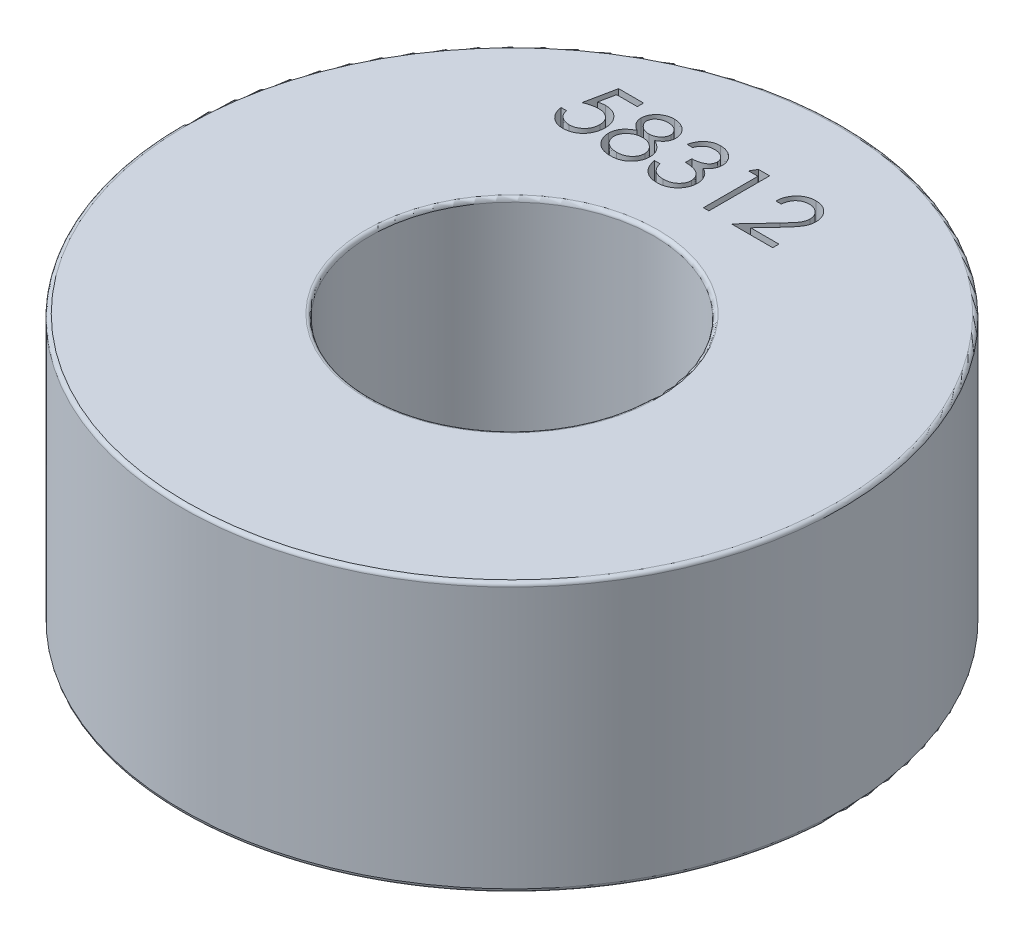
from build123d import *

# Parameters (mm, degrees)
CUT_EXTRUDE1_DEPTH = 1


with BuildPart() as part:
    # Toroidal Core TC229 → Revolve2 (revolve)
    with BuildSketch(Plane.XY, mode=Mode.PRIVATE) as revolve2_sk:
        with BuildLine():
            Line((5.719098459, 0), (12.780901541, 0))
            ThreePointArc((12.780901541, 0), (12.884180468, 0.042779532), (12.92696, 0.146058459))
            Line((12.92696, 0.146058459), (12.92696, 10.397861541))
            ThreePointArc((12.92696, 10.397861541), (12.884180468, 10.501140468), (12.780901541, 10.54392))
            Line((12.780901541, 10.54392), (5.719098459, 10.54392))
            ThreePointArc((5.719098459, 10.54392), (5.615819532, 10.501140468), (5.57304, 10.397861541))
            Line((5.57304, 10.397861541), (5.57304, 0.146058459))
            ThreePointArc((5.57304, 0.146058459), (5.615819532, 0.042779532), (5.719098459, 0))
        make_face()
    revolve(revolve2_sk.sketch.rotate(Axis((0, -8.107972275, 0), (0, 1, 0)), 90), axis=Axis((0, -8.107972275, 0), (0, 1, 0)))

    # Sketch1 → Cut-Extrude1 (cut)
    # profile 1 of 5: a face of its own
    with BuildSketch(Plane(origin=(0, 10.54392, 0), x_dir=(1, 0, 0), z_dir=(0, 1, 0))):
        with BuildLine():
            Line((-4.580535141, 9.741003225), (-4.580535141, 9.496772456))
            Line((-4.580535141, 9.496772456), (-5.39050359, 9.496772456))
            Line((-5.39050359, 9.496772456), (-5.518820147, 8.870454097))
            add(Edge.make_bspline(
                [(-5.518820147, 8.870454097), (-5.493608918, 8.877414335), (-5.444766149, 8.890898696), (-5.372675601, 8.90587048), (-5.304236977, 8.914895719), (-5.259826412, 8.916128057), (-5.238336372, 8.916724379)],
                knots=[0, 0, 0, 0, 1.100273476, 2.13160584, 3.095893838, 4, 4, 4, 4], degree=3))
            add(Edge.make_bspline(
                [(-5.238336372, 8.916724379), (-5.211745471, 8.916148841), (-5.159461115, 8.915017188), (-5.082962474, 8.904150627), (-5.009937774, 8.887046506), (-4.940539733, 8.863152008), (-4.874639965, 8.832597351), (-4.812844785, 8.794429355), (-4.754226633, 8.749843285), (-4.699837119, 8.698581768), (-4.650494687, 8.642165454), (-4.607111041, 8.58150626), (-4.570261136, 8.51719369), (-4.540624265, 8.448613275), (-4.516958495, 8.376523209), (-4.50120687, 8.300164969), (-4.490718002, 8.220258302), (-4.489546164, 8.165622514), (-4.488948602, 8.137761789)],
                knots=[0, 0, 0, 0, 1.052922333, 2.070308379, 3.05430497, 4.020497103, 4.973039431, 5.925935799, 6.892292201, 7.88610001, 8.88166317, 9.857072816, 10.836096531, 11.812156883, 12.81219415, 13.836441305, 14.89672472, 16, 16, 16, 16], degree=3))
            add(Edge.make_bspline(
                [(-4.488948602, 8.137761789), (-4.489401091, 8.118356493), (-4.490299953, 8.079808146), (-4.494870992, 8.022560038), (-4.503671899, 7.966523896), (-4.515488154, 7.911692287), (-4.530825049, 7.858169017), (-4.549391352, 7.805800888), (-4.572112578, 7.754913843), (-4.597034996, 7.705026387), (-4.625097332, 7.657266331), (-4.656243066, 7.612601575), (-4.689148874, 7.57036209), (-4.724555602, 7.53100089), (-4.76279235, 7.494776622), (-4.803396042, 7.461474309), (-4.846042678, 7.430530761), (-4.891392048, 7.403202043), (-4.93843363, 7.378054032), (-4.987846756, 7.357423196), (-5.038506626, 7.338978355), (-5.091142372, 7.324276158), (-5.145634769, 7.312755974), (-5.202073643, 7.304931458), (-5.260162992, 7.299232489), (-5.29953867, 7.298875739), (-5.31942862, 7.298695533)],
                knots=[0, 0, 0, 0, 1.056347294, 2.098418968, 3.122841568, 4.141288669, 5.149314143, 6.15115421, 7.162517403, 8.180376062, 9.185164535, 10.17417709, 11.141909838, 12.097768115, 13.052685741, 14.0056014, 14.954263652, 15.917497458, 16.885230207, 17.854509472, 18.828990115, 19.81800267, 20.826176721, 21.857883937, 22.917946725, 24, 24, 24, 24], degree=3))
            add(Edge.make_bspline(
                [(-5.31942862, 7.298695533), (-5.343155518, 7.29916555), (-5.389835387, 7.300090252), (-5.458225273, 7.3097639), (-5.524025745, 7.323618636), (-5.586707118, 7.344462241), (-5.646831138, 7.370579311), (-5.70358838, 7.403587635), (-5.758429096, 7.440993061), (-5.809123892, 7.485134872), (-5.856174748, 7.533382863), (-5.898293283, 7.585741544), (-5.935803806, 7.641346753), (-5.96810563, 7.700468533), (-5.995658748, 7.762951534), (-6.017304303, 7.829029861), (-6.034774755, 7.898358257), (-6.042165761, 7.946087699), (-6.045919756, 7.970330148)],
                knots=[0, 0, 0, 0, 1.0467383, 2.05933395, 3.04377827, 4.011590433, 4.970194871, 5.932262533, 6.905835911, 7.896367577, 8.894135286, 9.877477877, 10.858688626, 11.851381753, 12.8477658, 13.868841284, 14.917554742, 16, 16, 16, 16], degree=3))
            Line((-6.045919756, 7.970330148), (-5.832217833, 7.970330148))
            add(Edge.make_bspline(
                [(-5.832217833, 7.970330148), (-5.826959654, 7.947622241), (-5.816853141, 7.903976381), (-5.794669587, 7.842654879), (-5.767546554, 7.788009121), (-5.735294667, 7.739316244), (-5.69682045, 7.696855837), (-5.652917392, 7.659016372), (-5.603695102, 7.624879364), (-5.548998994, 7.596424946), (-5.491295809, 7.572157455), (-5.430902404, 7.555997819), (-5.369463197, 7.544635248), (-5.327908091, 7.543497853), (-5.307026276, 7.542926302)],
                knots=[0, 0, 0, 0, 1.136247022, 2.183929868, 3.172523383, 4.106158343, 5.02341133, 5.958108904, 6.928429099, 7.938127109, 8.96079061, 9.975095812, 10.982467395, 12, 12, 12, 12], degree=3))
            add(Edge.make_bspline(
                [(-5.307026276, 7.542926302), (-5.286643835, 7.543484724), (-5.24651064, 7.544584262), (-5.187447893, 7.553047233), (-5.130425206, 7.566081223), (-5.076005236, 7.585586964), (-5.023235689, 7.609293817), (-4.973451391, 7.639716038), (-4.925212112, 7.674727229), (-4.880017257, 7.714838794), (-4.838624703, 7.759041389), (-4.802051342, 7.80631083), (-4.77158705, 7.856736756), (-4.745914379, 7.909446169), (-4.726419903, 7.965016759), (-4.712512735, 8.023188094), (-4.704346368, 8.084103858), (-4.703222976, 8.125652799), (-4.702650525, 8.14682504)],
                knots=[0, 0, 0, 0, 1.027316725, 2.022795036, 3.002884548, 3.971462791, 4.93288096, 5.914575861, 6.907176829, 7.935150275, 8.956128384, 9.956726525, 10.942570165, 11.921478529, 12.907843606, 13.90538589, 14.932640048, 16, 16, 16, 16], degree=3))
            add(Edge.make_bspline(
                [(-4.702650525, 8.14682504), (-4.703098526, 8.165926578), (-4.703975425, 8.203315121), (-4.711139974, 8.258015296), (-4.723602057, 8.309772134), (-4.740899375, 8.358835568), (-4.762860969, 8.405251874), (-4.789698549, 8.449068956), (-4.821915772, 8.489709296), (-4.858717574, 8.527191909), (-4.899034206, 8.561784582), (-4.943559323, 8.591274041), (-4.991361166, 8.616082528), (-5.041863805, 8.637492005), (-5.096268495, 8.652868584), (-5.153497846, 8.664412806), (-5.214169857, 8.671090758), (-5.2556517, 8.672017329), (-5.276974443, 8.67249361)],
                knots=[0, 0, 0, 0, 1.045622112, 2.046656509, 3.013763289, 3.955457236, 4.890082067, 5.820317437, 6.762574623, 7.722996705, 8.69280354, 9.665887285, 10.63943826, 11.638615906, 12.663482002, 13.728887084, 14.832589034, 16, 16, 16, 16], degree=3))
            add(Edge.make_bspline(
                [(-5.276974443, 8.67249361), (-5.295431804, 8.672098601), (-5.333541571, 8.671283007), (-5.39199978, 8.665277836), (-5.453430398, 8.655590031), (-5.517597939, 8.642264387), (-5.584695106, 8.624826101), (-5.654580304, 8.603929271), (-5.727400471, 8.578945197), (-5.77646628, 8.560077387), (-5.801688987, 8.550378225)],
                knots=[0, 0, 0, 0, 0.817624296, 1.688186739, 2.600797293, 3.572016777, 4.590301741, 5.671205678, 6.80286297, 8, 8, 8, 8], degree=3))
            Line((-5.801688987, 8.550378225), (-5.557458217, 9.741003225))
            Line((-5.557458217, 9.741003225), (-4.580535141, 9.741003225))
        make_face()
    # profile 2 of 5: a face of its own
    with BuildSketch(Plane(origin=(0, 10.54392, 0), x_dir=(1, 0, 0), z_dir=(0, 1, 0))):
        with BuildLine():
            add(Edge.make_bspline(
                [(-3.087006745, 8.686326993), (-3.067515501, 8.676163848), (-3.029501067, 8.656342321), (-2.975360145, 8.624426205), (-2.925881171, 8.590788691), (-2.879691342, 8.55701858), (-2.837602169, 8.521822581), (-2.800084274, 8.485060737), (-2.766210911, 8.447650657), (-2.736665189, 8.408958855), (-2.710677698, 8.369088124), (-2.688217656, 8.327933815), (-2.669019881, 8.285586118), (-2.653805095, 8.241582775), (-2.641271698, 8.196570168), (-2.632647759, 8.149967077), (-2.628009821, 8.102080588), (-2.627132967, 8.069717154), (-2.626688987, 8.053330449)],
                knots=[0, 0, 0, 0, 1.272397273, 2.481599622, 3.635517121, 4.734568067, 5.792894095, 6.808321871, 7.773003508, 8.711915296, 9.623354172, 10.525449501, 11.423591555, 12.311487226, 13.218079475, 14.126165749, 15.051214107, 16, 16, 16, 16], degree=3))
            add(Edge.make_bspline(
                [(-2.626688987, 8.053330449), (-2.627213828, 8.030403956), (-2.628252686, 7.985023824), (-2.637301425, 7.918045308), (-2.650849363, 7.85299515), (-2.670633817, 7.789887609), (-2.696292391, 7.72907091), (-2.727913239, 7.670492994), (-2.763707648, 7.613193786), (-2.792454261, 7.577938086), (-2.806999984, 7.560098778)],
                knots=[0, 0, 0, 0, 1.025265484, 2.029385089, 3.018602448, 3.995076438, 4.983346944, 5.966715145, 6.97116228, 8, 8, 8, 8], degree=3))
            add(Edge.make_bspline(
                [(-2.806999984, 7.560098778), (-2.825938728, 7.539284085), (-2.863582185, 7.497911913), (-2.928068427, 7.444197165), (-2.998840459, 7.399055881), (-3.075624432, 7.362267681), (-3.158215095, 7.333634267), (-3.246594852, 7.313058554), (-3.340935999, 7.301273115), (-3.405777757, 7.299569508), (-3.439042502, 7.298695533)],
                knots=[0, 0, 0, 0, 0.954267603, 1.896743057, 2.838368354, 3.796610408, 4.779680527, 5.799409237, 6.871065594, 8, 8, 8, 8], degree=3))
            add(Edge.make_bspline(
                [(-3.439042502, 7.298695533), (-3.471028397, 7.29947963), (-3.533269699, 7.301005402), (-3.623864612, 7.311343042), (-3.70831263, 7.329459501), (-3.787104769, 7.354254852), (-3.859766023, 7.386510739), (-3.926089347, 7.426657531), (-3.987031639, 7.47307928), (-4.040743436, 7.527109216), (-4.088428609, 7.584978947), (-4.130316874, 7.644681381), (-4.165133524, 7.706221969), (-4.194611423, 7.768683087), (-4.217177524, 7.832940202), (-4.232806831, 7.898662711), (-4.242732775, 7.965735818), (-4.24405344, 8.011001103), (-4.244717833, 8.033772907)],
                knots=[0, 0, 0, 0, 1.256902934, 2.445805442, 3.576955095, 4.645999104, 5.686449165, 6.692658513, 7.68621702, 8.689161843, 9.678783111, 10.630372946, 11.551080876, 12.453998257, 13.34127905, 14.221779781, 15.105423033, 16, 16, 16, 16], degree=3))
            add(Edge.make_bspline(
                [(-4.244717833, 8.033772907), (-4.244324667, 8.050481929), (-4.243547634, 8.083504853), (-4.238169514, 8.132292807), (-4.229523221, 8.179779106), (-4.217780626, 8.226139147), (-4.201866375, 8.27103542), (-4.182651638, 8.314680653), (-4.160246148, 8.357124121), (-4.134337356, 8.398597931), (-4.104196157, 8.438520956), (-4.07006696, 8.477570731), (-4.031267642, 8.515141323), (-3.988229842, 8.551691758), (-3.941445396, 8.587870412), (-3.889699112, 8.621722077), (-3.834362762, 8.6556433), (-3.795034442, 8.675923607), (-3.77485981, 8.686326993)],
                knots=[0, 0, 0, 0, 0.941657376, 1.861047343, 2.762797495, 3.66048619, 4.553285746, 5.444104102, 6.34607688, 7.256116206, 8.197091036, 9.162375105, 10.176350973, 11.237807142, 12.343728897, 13.50695164, 14.721116704, 16, 16, 16, 16], degree=3))
            add(Edge.make_bspline(
                [(-3.77485981, 8.686326993), (-3.802476442, 8.701386541), (-3.855949971, 8.730546041), (-3.926754358, 8.784121993), (-3.987571907, 8.842148167), (-4.036730921, 8.905849867), (-4.075424347, 8.973237115), (-4.101970933, 9.043888294), (-4.11992997, 9.116493364), (-4.121708986, 9.166095616), (-4.122602448, 9.191006981)],
                knots=[0, 0, 0, 0, 1.166880483, 2.259407225, 3.286803203, 4.280235371, 5.237608625, 6.161067461, 7.076446754, 8, 8, 8, 8], degree=3))
            add(Edge.make_bspline(
                [(-4.122602448, 9.191006981), (-4.121489776, 9.216382642), (-4.11925311, 9.267392144), (-4.101166958, 9.343324167), (-4.071693841, 9.41790258), (-4.03160652, 9.490765913), (-3.981677003, 9.559448113), (-3.921773907, 9.621048293), (-3.853327735, 9.675008426), (-3.776680151, 9.720304001), (-3.694196212, 9.75716824), (-3.607167836, 9.782598917), (-3.517111347, 9.799224204), (-3.45581272, 9.801106517), (-3.424732106, 9.802060918)],
                knots=[0, 0, 0, 0, 0.888701115, 1.786444228, 2.72001202, 3.692817113, 4.693886446, 5.687152267, 6.695133018, 7.739871481, 8.800368666, 9.853104506, 10.91144658, 12, 12, 12, 12], degree=3))
            add(Edge.make_bspline(
                [(-3.424732106, 9.802060918), (-3.394453617, 9.801076888), (-3.334747888, 9.799136493), (-3.246985471, 9.782952921), (-3.163012474, 9.755922658), (-3.083118476, 9.719253297), (-3.008733759, 9.674086468), (-2.943009688, 9.619385159), (-2.884953056, 9.558056711), (-2.836930459, 9.489395338), (-2.797358922, 9.416811985), (-2.769803845, 9.340868805), (-2.752147234, 9.263206678), (-2.749920177, 9.21065725), (-2.748804371, 9.184328796)],
                knots=[0, 0, 0, 0, 1.072916533, 2.115669174, 3.151510826, 4.193348718, 5.225979165, 6.227137561, 7.216255879, 8.211077061, 9.189680878, 10.138522389, 11.067357538, 12, 12, 12, 12], degree=3))
            add(Edge.make_bspline(
                [(-2.748804371, 9.184328796), (-2.749780385, 9.158491102), (-2.75169722, 9.107747338), (-2.767821643, 9.033774473), (-2.794976951, 8.964499122), (-2.832052444, 8.899135203), (-2.880375142, 8.838868148), (-2.939300012, 8.782931585), (-3.008357268, 8.730866011), (-3.060241907, 8.70148386), (-3.087006745, 8.686326993)],
                knots=[0, 0, 0, 0, 0.975232327, 1.915300861, 2.843280834, 3.77672583, 4.742871857, 5.749627742, 6.839139064, 8, 8, 8, 8], degree=3))
        make_face()
        with BuildLine():
            add(Edge.make_bspline(
                [(-3.436657436, 9.557830148), (-3.453360752, 9.557386936), (-3.486039742, 9.556519819), (-3.533956392, 9.551989568), (-3.57952152, 9.543176754), (-3.623211199, 9.531448274), (-3.664426426, 9.515604125), (-3.703726954, 9.496965735), (-3.740443917, 9.474305715), (-3.775020553, 9.448886757), (-3.80614742, 9.420928905), (-3.833773016, 9.391800286), (-3.85672018, 9.360928813), (-3.876206363, 9.329082412), (-3.890345217, 9.295315895), (-3.900934502, 9.260664505), (-3.908092806, 9.22469036), (-3.908629193, 9.200104627), (-3.908900525, 9.187667889)],
                knots=[0, 0, 0, 0, 1.203892937, 2.355340988, 3.463153438, 4.544400666, 5.610487187, 6.640501085, 7.674077295, 8.714426146, 9.728707835, 10.68524104, 11.601827946, 12.495867327, 13.368432065, 14.231010473, 15.105153427, 16, 16, 16, 16], degree=3))
            add(Edge.make_bspline(
                [(-3.908900525, 9.187667889), (-3.90843287, 9.175230614), (-3.907508717, 9.150652771), (-3.900361478, 9.11435853), (-3.889709225, 9.078693095), (-3.872937971, 9.044504529), (-3.852822288, 9.01060685), (-3.827995052, 8.977847255), (-3.798406981, 8.946111735), (-3.765050812, 8.915670215), (-3.728711891, 8.887164092), (-3.690214533, 8.862417338), (-3.650041898, 8.841711274), (-3.608606741, 8.824478232), (-3.565486761, 8.811082043), (-3.520946178, 8.801578374), (-3.474977506, 8.795671516), (-3.443830361, 8.794965971), (-3.428071198, 8.794608995)],
                knots=[0, 0, 0, 0, 0.873023192, 1.725219244, 2.590779336, 3.480155217, 4.391973325, 5.357036234, 6.360879153, 7.436073238, 8.526419356, 9.601555421, 10.645666583, 11.697338044, 12.750135903, 13.812665442, 14.89329948, 16, 16, 16, 16], degree=3))
            add(Edge.make_bspline(
                [(-3.428071198, 8.794608995), (-3.407830503, 8.795202856), (-3.367549027, 8.796384713), (-3.308167911, 8.80737328), (-3.250431005, 8.824658377), (-3.194955428, 8.848307569), (-3.14317713, 8.877990095), (-3.097021655, 8.913527202), (-3.056882698, 8.954098325), (-3.02317739, 8.999071861), (-2.997044976, 9.046936067), (-2.976701068, 9.09496948), (-2.964821205, 9.14368457), (-2.963271646, 9.176319236), (-2.962506294, 9.192438021)],
                knots=[0, 0, 0, 0, 1.076279235, 2.141928126, 3.20205304, 4.278698113, 5.344010996, 6.36967002, 7.368914609, 8.37248503, 9.349703398, 10.264243087, 11.142681841, 12, 12, 12, 12], degree=3))
            add(Edge.make_bspline(
                [(-2.962506294, 9.192438021), (-2.962868175, 9.203751024), (-2.963586455, 9.226205713), (-2.9695056, 9.259365208), (-2.979286301, 9.291770336), (-2.992528147, 9.323688795), (-3.009951953, 9.354672757), (-3.030610445, 9.385209287), (-3.055705079, 9.41461144), (-3.083869438, 9.443564412), (-3.115809083, 9.470359614), (-3.151462459, 9.493923586), (-3.190646778, 9.513934493), (-3.233362967, 9.530187378), (-3.27945371, 9.542394584), (-3.328706719, 9.551536099), (-3.381532674, 9.556688519), (-3.417883986, 9.557441352), (-3.436657436, 9.557830148)],
                knots=[0, 0, 0, 0, 0.814439003, 1.616544685, 2.417341072, 3.248991801, 4.09997495, 4.973547432, 5.9003056, 6.880240646, 7.880314356, 8.896779544, 9.951930927, 11.043077905, 12.18215768, 13.381699519, 14.647792085, 16, 16, 16, 16], degree=3))
        make_face(mode=Mode.SUBTRACT)
        with BuildLine():
            add(Edge.make_bspline(
                [(-3.422824053, 8.550378225), (-3.444000703, 8.550001551), (-3.485544124, 8.549262609), (-3.546406785, 8.541037431), (-3.604817599, 8.529587433), (-3.660579627, 8.512217345), (-3.713669322, 8.489631876), (-3.764374082, 8.462462126), (-3.812306012, 8.430345566), (-3.856803224, 8.393690226), (-3.897436417, 8.354189062), (-3.933085975, 8.312372859), (-3.963360181, 8.269018779), (-3.987739589, 8.223576208), (-4.007750071, 8.177007387), (-4.020890405, 8.128152577), (-4.029314391, 8.077950987), (-4.030445575, 8.043824206), (-4.03101591, 8.026617708)],
                knots=[0, 0, 0, 0, 1.140299081, 2.23698856, 3.303958914, 4.344563908, 5.37730929, 6.408454204, 7.439741482, 8.480804886, 9.510774543, 10.48932336, 11.43758569, 12.353841022, 13.263987381, 14.161954604, 15.073269652, 16, 16, 16, 16], degree=3))
            add(Edge.make_bspline(
                [(-4.03101591, 8.026617708), (-4.030088407, 8.005233467), (-4.028248263, 7.962807632), (-4.013650085, 7.900103828), (-3.990221623, 7.839401646), (-3.957547324, 7.781195764), (-3.917088136, 7.726801138), (-3.867336022, 7.679387881), (-3.81138288, 7.637259161), (-3.747335519, 7.603186513), (-3.677375437, 7.575975727), (-3.601521243, 7.557227831), (-3.520861558, 7.54481713), (-3.465167799, 7.543566511), (-3.436657436, 7.542926302)],
                knots=[0, 0, 0, 0, 0.898778495, 1.783155532, 2.693654817, 3.627872908, 4.583023416, 5.533784346, 6.509005473, 7.520592997, 8.575161974, 9.658835044, 10.801527049, 12, 12, 12, 12], degree=3))
            add(Edge.make_bspline(
                [(-3.436657436, 7.542926302), (-3.414375489, 7.543354117), (-3.370963112, 7.544187636), (-3.307631422, 7.551545218), (-3.247865756, 7.563213088), (-3.191782012, 7.580183608), (-3.138752364, 7.600900467), (-3.089675922, 7.627551472), (-3.043290174, 7.657862963), (-3.001880833, 7.693825388), (-2.964166453, 7.732251615), (-2.931282553, 7.772930198), (-2.902736433, 7.814755584), (-2.880331622, 7.858672967), (-2.862420367, 7.903839779), (-2.849545592, 7.95067251), (-2.841601595, 7.999314803), (-2.840798164, 8.032311492), (-2.84039091, 8.04903733)],
                knots=[0, 0, 0, 0, 1.224942928, 2.386581632, 3.501229538, 4.569074225, 5.605009692, 6.626002462, 7.634866581, 8.645888296, 9.63523824, 10.59253846, 11.518950513, 12.414518923, 13.29783783, 14.186679152, 15.080837789, 16, 16, 16, 16], degree=3))
            add(Edge.make_bspline(
                [(-2.84039091, 8.04903733), (-2.84100721, 8.065282449), (-2.842222447, 8.097314986), (-2.849935446, 8.144781141), (-2.863485355, 8.190639127), (-2.882077745, 8.235440649), (-2.906829793, 8.278277942), (-2.935979606, 8.32026698), (-2.971150069, 8.360242347), (-3.010891496, 8.398514543), (-3.054202325, 8.433903821), (-3.10024015, 8.465210073), (-3.148650597, 8.491575352), (-3.199331224, 8.513017825), (-3.252169499, 8.529882157), (-3.307126557, 8.541663218), (-3.364266743, 8.54907884), (-3.403084432, 8.549940204), (-3.422824053, 8.550378225)],
                knots=[0, 0, 0, 0, 0.917430815, 1.809013306, 2.70690318, 3.612392954, 4.541220862, 5.495268465, 6.494511384, 7.542276156, 8.608045339, 9.649016899, 10.681629292, 11.715607085, 12.752076957, 13.808767841, 14.885711793, 16, 16, 16, 16], degree=3))
        make_face(mode=Mode.SUBTRACT)
    # profile 3 of 5: a face of its own
    with BuildSketch(Plane(origin=(0, 10.54392, 0), x_dir=(1, 0, 0), z_dir=(0, 1, 0))):
        with BuildLine():
            Line((-2.107698602, 9.191483995), (-2.321400525, 9.191483995))
            add(Edge.make_bspline(
                [(-2.321400525, 9.191483995), (-2.315610992, 9.215454667), (-2.304292927, 9.26231537), (-2.280686185, 9.329267453), (-2.254969192, 9.392624706), (-2.22408839, 9.451200785), (-2.190404756, 9.506172895), (-2.151813047, 9.55629421), (-2.110093736, 9.60283946), (-2.063948547, 9.644146145), (-2.015555654, 9.681550635), (-1.964233172, 9.713442416), (-1.911013667, 9.740877241), (-1.855528411, 9.763478863), (-1.797612212, 9.780505157), (-1.737788664, 9.792858269), (-1.675900997, 9.800880438), (-1.633890583, 9.801663368), (-1.612558879, 9.802060918)],
                knots=[0, 0, 0, 0, 1.162005537, 2.271625781, 3.343758855, 4.383309926, 5.390229558, 6.379919256, 7.361854164, 8.333198761, 9.295911338, 10.242430842, 11.177959212, 12.116337295, 13.062827104, 14.020064771, 14.994644689, 16, 16, 16, 16], degree=3))
            add(Edge.make_bspline(
                [(-1.612558879, 9.802060918), (-1.581478299, 9.801122548), (-1.519995097, 9.799266279), (-1.429668809, 9.782315564), (-1.342564848, 9.755492393), (-1.259636628, 9.718430804), (-1.182607659, 9.672719436), (-1.114071074, 9.618314856), (-1.054955856, 9.55626676), (-1.005361645, 9.48773264), (-0.966530262, 9.414488445), (-0.937896497, 9.339104767), (-0.920464603, 9.261760426), (-0.918205439, 9.209538062), (-0.917073602, 9.18337477)],
                knots=[0, 0, 0, 0, 1.083050992, 2.142477498, 3.193116406, 4.255571735, 5.30263384, 6.308962982, 7.297363603, 8.282367274, 9.249857812, 10.179914175, 11.08814088, 12, 12, 12, 12], degree=3))
            add(Edge.make_bspline(
                [(-0.917073602, 9.18337477), (-0.91786526, 9.158196933), (-0.91941441, 9.108927813), (-0.932568235, 9.036999437), (-0.954704514, 8.969207562), (-0.985368049, 8.905266807), (-1.025061139, 8.845582586), (-1.073143813, 8.790020614), (-1.129955446, 8.738334454), (-1.173007723, 8.70872567), (-1.19517231, 8.693482192)],
                knots=[0, 0, 0, 0, 1.024540389, 2.004866551, 2.965041327, 3.920577974, 4.882998113, 5.874504559, 6.905732034, 8, 8, 8, 8], degree=3))
            add(Edge.make_bspline(
                [(-1.19517231, 8.693482192), (-1.16984142, 8.681250614), (-1.1196536, 8.657016322), (-1.051243329, 8.609489458), (-0.989141775, 8.554614336), (-0.954509066, 8.511790853), (-0.937108157, 8.490274559)],
                knots=[0, 0, 0, 0, 1.015518401, 2.012035669, 3.001164323, 4, 4, 4, 4], degree=3))
            add(Edge.make_bspline(
                [(-0.937108157, 8.490274559), (-0.92565003, 8.474587053), (-0.902921409, 8.443468935), (-0.874866519, 8.393437903), (-0.849414961, 8.342852336), (-0.829582401, 8.290356383), (-0.81422411, 8.236558493), (-0.803245845, 8.181366291), (-0.796425849, 8.124734708), (-0.795449161, 8.08642211), (-0.794958217, 8.067163832)],
                knots=[0, 0, 0, 0, 1.025084078, 2.033381695, 3.024893161, 4.013698104, 4.991890475, 5.976764909, 6.982997093, 8, 8, 8, 8], degree=3))
            add(Edge.make_bspline(
                [(-0.794958217, 8.067163832), (-0.796179128, 8.033819718), (-0.798615202, 7.967288409), (-0.820389403, 7.868994), (-0.854144125, 7.772910221), (-0.902080005, 7.681011089), (-0.960500578, 7.595027294), (-1.030004043, 7.518095019), (-1.109800689, 7.451965255), (-1.198795246, 7.396713296), (-1.295213507, 7.352545924), (-1.398339044, 7.321890771), (-1.506685955, 7.30192501), (-1.58098592, 7.299784016), (-1.61876005, 7.298695533)],
                knots=[0, 0, 0, 0, 0.955779014, 1.907060117, 2.875433937, 3.871313158, 4.872415639, 5.851225146, 6.836215519, 7.83643374, 8.849228613, 9.86973379, 10.916971861, 12, 12, 12, 12], degree=3))
            add(Edge.make_bspline(
                [(-1.61876005, 7.298695533), (-1.644218539, 7.299286228), (-1.694312354, 7.300448519), (-1.767956591, 7.308394139), (-1.838252247, 7.32290616), (-1.905294367, 7.342434659), (-1.969142508, 7.367194041), (-2.029601836, 7.398026941), (-2.087044317, 7.434297802), (-2.14092789, 7.476434761), (-2.191246129, 7.523570815), (-2.236661822, 7.576542749), (-2.277932145, 7.634371339), (-2.313952048, 7.697728276), (-2.346362189, 7.765794781), (-2.373019233, 7.83944242), (-2.396481736, 7.9180128), (-2.407390217, 7.972766405), (-2.412987064, 8.000858995)],
                knots=[0, 0, 0, 0, 1.048658725, 2.063410685, 3.046034179, 4.001477787, 4.936774919, 5.862367409, 6.792675028, 7.730719943, 8.675894397, 9.627829632, 10.600096036, 11.597688215, 12.626045268, 13.701542398, 14.82072376, 16, 16, 16, 16], degree=3))
            Line((-2.412987064, 8.000858995), (-2.199285141, 8.000858995))
            add(Edge.make_bspline(
                [(-2.199285141, 8.000858995), (-2.19371758, 7.982524041), (-2.18288819, 7.946860963), (-2.164454391, 7.895534613), (-2.143452942, 7.848482437), (-2.120923215, 7.805359277), (-2.097261451, 7.765740446), (-2.070785404, 7.730673568), (-2.043456039, 7.698618403), (-2.022855265, 7.680558587), (-2.012772971, 7.671719872)],
                knots=[0, 0, 0, 0, 1.198163088, 2.33053128, 3.407730985, 4.417276592, 5.372219308, 6.28897303, 7.162600585, 8, 8, 8, 8], degree=3))
            add(Edge.make_bspline(
                [(-2.012772971, 7.671719872), (-1.9994403, 7.661440809), (-1.972816114, 7.640914412), (-1.929430942, 7.614719554), (-1.883802868, 7.592022143), (-1.834943241, 7.574684128), (-1.783906406, 7.560003613), (-1.729867431, 7.550396616), (-1.673303071, 7.5438052), (-1.634680717, 7.543223541), (-1.614943945, 7.542926302)],
                knots=[0, 0, 0, 0, 0.946170439, 1.889420265, 2.845303464, 3.807233317, 4.801018734, 5.828864929, 6.890507805, 8, 8, 8, 8], degree=3))
            add(Edge.make_bspline(
                [(-1.614943945, 7.542926302), (-1.592659865, 7.543345338), (-1.549085271, 7.544164726), (-1.48550259, 7.551700162), (-1.425013773, 7.562674604), (-1.368290408, 7.57962433), (-1.314589473, 7.600566302), (-1.264663744, 7.626861021), (-1.217857822, 7.657711626), (-1.174771208, 7.69277666), (-1.136027925, 7.731163428), (-1.101915149, 7.771313392), (-1.072915157, 7.813057269), (-1.049522044, 7.856626062), (-1.031049973, 7.901839352), (-1.018474795, 7.948824019), (-1.009731175, 7.997195552), (-1.009019105, 8.030076512), (-1.008660141, 8.046652264)],
                knots=[0, 0, 0, 0, 1.217147791, 2.380027433, 3.494444702, 4.572153297, 5.609568379, 6.639424714, 7.649109417, 8.668170816, 9.669597737, 10.625200337, 11.543417969, 12.441394052, 13.322311151, 14.205496177, 15.095365482, 16, 16, 16, 16], degree=3))
            add(Edge.make_bspline(
                [(-1.008660141, 8.046652264), (-1.009701292, 8.068839621), (-1.011778415, 8.113103935), (-1.027636573, 8.17822607), (-1.053720693, 8.240970927), (-1.09023717, 8.300267992), (-1.134688799, 8.355224453), (-1.186644209, 8.404258801), (-1.246534843, 8.444719702), (-1.30165729, 8.472674663), (-1.350483227, 8.491749888), (-1.392267622, 8.504455533), (-1.439046668, 8.515214467), (-1.490254666, 8.525224066), (-1.546277462, 8.533743054), (-1.607054063, 8.540847218), (-1.672596787, 8.54653163), (-1.717970598, 8.549070107), (-1.741352448, 8.550378225)],
                knots=[0, 0, 0, 0, 1.07054697, 2.135767047, 3.216561865, 4.33974944, 5.486079747, 6.621378074, 7.775625952, 8.963672916, 9.598146892, 10.304877434, 11.070270905, 11.915000392, 12.823868403, 13.805723172, 14.86925407, 16, 16, 16, 16], degree=3))
            Line((-1.741352448, 8.550378225), (-1.741352448, 8.794608995))
            add(Edge.make_bspline(
                [(-1.741352448, 8.794608995), (-1.711892191, 8.795108923), (-1.654186784, 8.796088162), (-1.569894408, 8.807931826), (-1.489290244, 8.824315253), (-1.414160622, 8.849410357), (-1.345683551, 8.878557059), (-1.286275036, 8.912474366), (-1.236767387, 8.950176186), (-1.197401194, 8.992244444), (-1.167785772, 9.03736236), (-1.146132183, 9.084386372), (-1.133341247, 9.133728635), (-1.131633777, 9.167402685), (-1.130775525, 9.184328796)],
                knots=[0, 0, 0, 0, 1.321986639, 2.589447074, 3.816329219, 5.01088745, 6.139805852, 7.153945165, 8.075214402, 8.924034688, 9.728124013, 10.488707548, 11.240355623, 12, 12, 12, 12], degree=3))
            add(Edge.make_bspline(
                [(-1.130775525, 9.184328796), (-1.131057473, 9.196764191), (-1.131618394, 9.221503818), (-1.138692256, 9.257647838), (-1.149322184, 9.292686875), (-1.163936071, 9.32647192), (-1.183496474, 9.35876866), (-1.206904833, 9.389852443), (-1.234777772, 9.419545799), (-1.266717443, 9.447222945), (-1.301015474, 9.473599873), (-1.338605053, 9.495992901), (-1.378352793, 9.515141595), (-1.420302699, 9.530932345), (-1.464590908, 9.542810897), (-1.511009334, 9.551339746), (-1.55964649, 9.55667215), (-1.592828687, 9.557439876), (-1.609696799, 9.557830148)],
                knots=[0, 0, 0, 0, 0.884392785, 1.759457502, 2.611959086, 3.489218968, 4.37281399, 5.2945488, 6.255912374, 7.266815255, 8.301784654, 9.332968512, 10.37626691, 11.440494194, 12.520033166, 13.637162961, 14.798855837, 16, 16, 16, 16], degree=3))
            add(Edge.make_bspline(
                [(-1.609696799, 9.557830148), (-1.636810166, 9.556883525), (-1.689768878, 9.55503455), (-1.766115098, 9.53884), (-1.837089502, 9.51300134), (-1.891340274, 9.482158696), (-1.931401454, 9.451712419), (-1.960028799, 9.425122438), (-1.988141503, 9.395572606), (-2.01389008, 9.36124289), (-2.039930053, 9.324458163), (-2.0636368, 9.28334848), (-2.086673483, 9.238986205), (-2.100554504, 9.20762471), (-2.107698602, 9.191483995)],
                knots=[0, 0, 0, 0, 1.472543308, 2.876219568, 4.221790263, 5.565193594, 6.249813518, 6.953379497, 7.687249741, 8.463570142, 9.283606569, 10.136032583, 11.040678096, 12, 12, 12, 12], degree=3))
        make_face()
    # profile 4 of 5: a face of its own
    with BuildSketch(Plane(origin=(0, 10.54392, 0), x_dir=(1, 0, 0), z_dir=(0, 1, 0))):
        Polygon((-0.075145267, 9.741003225), (0.365137936, 9.741003225), (0.365137936, 7.359753225), (0.151436013, 7.359753225), (0.151436013, 9.496772456), (-0.214910141, 9.496772456), align=None)
    # profile 5 of 5: a face of its own
    with BuildSketch(Plane(origin=(0, 10.54392, 0), x_dir=(1, 0, 0), z_dir=(0, 1, 0))):
        with BuildLine():
            Line((1.555762936, 9.008310918), (1.342061013, 9.008310918))
            add(Edge.make_bspline(
                [(1.342061013, 9.008310918), (1.343453808, 9.036662004), (1.346189221, 9.092342782), (1.358999182, 9.173525654), (1.3773286, 9.251123651), (1.403244393, 9.324513718), (1.435429557, 9.394344764), (1.474026237, 9.460339417), (1.519742053, 9.522245922), (1.571589849, 9.579490385), (1.627902083, 9.6320055), (1.688662017, 9.677354871), (1.752510152, 9.715671001), (1.819252779, 9.74770306), (1.889642912, 9.771746777), (1.963041785, 9.789586857), (2.039771876, 9.800320406), (2.092050534, 9.801474146), (2.118638537, 9.802060918)],
                knots=[0, 0, 0, 0, 1.10065271, 2.161652631, 3.183658789, 4.190468796, 5.17591951, 6.163126047, 7.15150782, 8.156236427, 9.156009102, 10.134482811, 11.092018607, 12.041330605, 13.001268258, 13.972401359, 14.968799086, 16, 16, 16, 16], degree=3))
            add(Edge.make_bspline(
                [(2.118638537, 9.802060918), (2.144749334, 9.801449646), (2.196056117, 9.80024852), (2.270937595, 9.789933606), (2.342223576, 9.773778123), (2.409774717, 9.751111741), (2.473052057, 9.720642336), (2.53253095, 9.684040797), (2.588919502, 9.64170909), (2.63967876, 9.591870335), (2.686288721, 9.538664784), (2.726499362, 9.481863192), (2.76093439, 9.423196482), (2.789637079, 9.362217295), (2.810766345, 9.29835147), (2.826807947, 9.232528819), (2.835875348, 9.16406801), (2.837266967, 9.117731229), (2.837974475, 9.094173297)],
                knots=[0, 0, 0, 0, 1.111607364, 2.184268762, 3.212621178, 4.221274766, 5.211760367, 6.196651075, 7.1921475, 8.207485113, 9.220403448, 10.201281604, 11.166441695, 12.114753415, 13.065576456, 14.026450734, 14.996634279, 16, 16, 16, 16], degree=3))
            add(Edge.make_bspline(
                [(2.837974475, 9.094173297), (2.836822451, 9.06100736), (2.834538621, 8.9952575), (2.81500259, 8.898636674), (2.784490945, 8.805024009), (2.747753458, 8.729683094), (2.710692742, 8.668972449), (2.677295705, 8.618987491), (2.638199111, 8.565167521), (2.592833918, 8.507692761), (2.542138553, 8.44611302), (2.485653832, 8.380465498), (2.422976963, 8.311428455), (2.37898609, 8.264275894), (2.356191121, 8.239842618)],
                knots=[0, 0, 0, 0, 1.184426356, 2.348067706, 3.509069118, 4.696110526, 5.333549288, 6.050745305, 6.844228056, 7.710549037, 8.667450064, 9.695053472, 10.805634456, 12, 12, 12, 12], degree=3))
            Line((2.356191121, 8.239842618), (1.760401608, 7.603983995))
            Line((1.760401608, 7.603983995), (2.868503321, 7.603983995))
            Line((2.868503321, 7.603983995), (2.868503321, 7.359753225))
            Line((2.868503321, 7.359753225), (1.250474475, 7.359753225))
            Line((1.250474475, 7.359753225), (2.173972071, 8.34526254))
            add(Edge.make_bspline(
                [(2.173972071, 8.34526254), (2.196456437, 8.368733709), (2.239644302, 8.413817022), (2.30072852, 8.479636786), (2.355591831, 8.540698527), (2.404589379, 8.596886875), (2.446658246, 8.64902371), (2.483990961, 8.695420464), (2.513903265, 8.738115902), (2.546366775, 8.787605498), (2.577808787, 8.848029593), (2.604827372, 8.921871263), (2.621302117, 8.997885698), (2.623278443, 9.049254048), (2.624272552, 9.075092769)],
                knots=[0, 0, 0, 0, 1.329631726, 2.553950428, 3.673215718, 4.687767853, 5.603093632, 6.413772471, 7.123043292, 7.734684054, 8.834405432, 9.900288307, 10.943827018, 12, 12, 12, 12], degree=3))
            add(Edge.make_bspline(
                [(2.624272552, 9.075092769), (2.62384002, 9.091340649), (2.622987583, 9.1233621), (2.615464399, 9.170310661), (2.604095287, 9.215598508), (2.58780396, 9.259364943), (2.566300088, 9.301169931), (2.54012445, 9.34106436), (2.509923353, 9.379633102), (2.47498615, 9.415796328), (2.43660617, 9.448916934), (2.396060796, 9.478256714), (2.353164207, 9.50277618), (2.308097267, 9.522876309), (2.260985617, 9.538643846), (2.211738139, 9.549569415), (2.160490907, 9.556429105), (2.12549776, 9.557357229), (2.107667233, 9.557830148)],
                knots=[0, 0, 0, 0, 0.991446411, 1.95395049, 2.89581595, 3.838931463, 4.798493298, 5.75982156, 6.748411868, 7.785213223, 8.824556874, 9.840280684, 10.836137867, 11.835679398, 12.848801643, 13.863922112, 14.911575587, 16, 16, 16, 16], degree=3))
            add(Edge.make_bspline(
                [(2.107667233, 9.557830148), (2.089045292, 9.557343671), (2.052474873, 9.55638831), (1.998781745, 9.54970539), (1.947560529, 9.538176167), (1.898682377, 9.522407751), (1.852064587, 9.502365417), (1.807933872, 9.477401926), (1.766389299, 9.447613514), (1.727352771, 9.413840207), (1.691386386, 9.3762385), (1.659785922, 9.334321721), (1.632174298, 9.288855212), (1.608083373, 9.239961651), (1.588519234, 9.187197383), (1.573569644, 9.130749713), (1.561740379, 9.070863737), (1.55778851, 9.02950817), (1.555762936, 9.008310918)],
                knots=[0, 0, 0, 0, 1.031018746, 2.02475058, 2.990194455, 3.934040569, 4.864654155, 5.795059489, 6.735614925, 7.690564532, 8.649604399, 9.611025574, 10.590972636, 11.591080095, 12.624614302, 13.701020113, 14.821632451, 16, 16, 16, 16], degree=3))
        make_face()
    extrude(amount=-CUT_EXTRUDE1_DEPTH, mode=Mode.SUBTRACT)


solid = part.part
